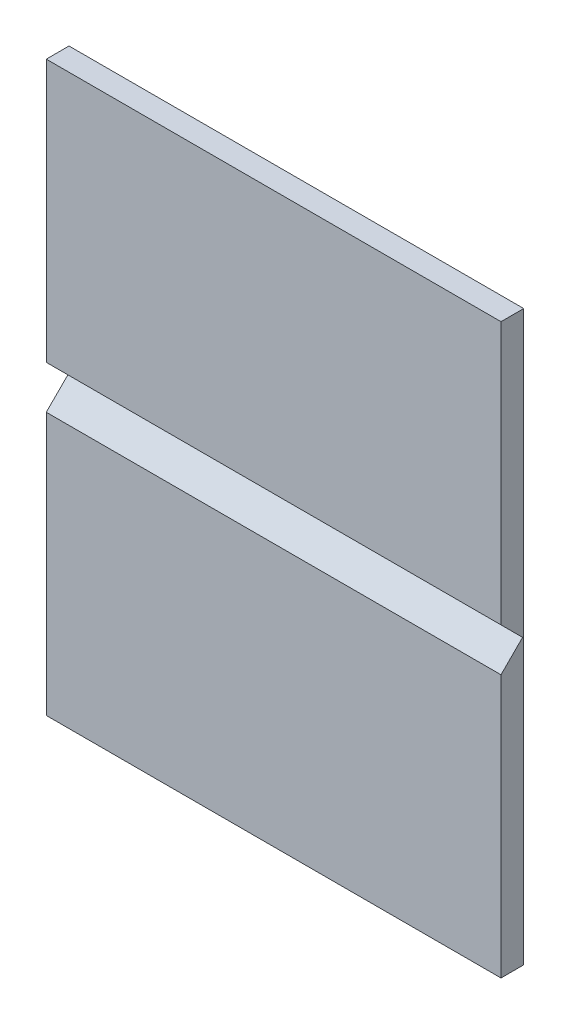
from build123d import *

# Parameters (mm, degrees)
SKETCH1_W           = 400
SKETCH1_H           = 500
BOSS_EXTRUDE1_DEPTH = 20
CUT_EXTRUDE2_DEPTH  = 473.122865365


with BuildPart() as part:
    # Sketch1 → Boss-Extrude1 (new body)
    with BuildSketch(Plane.XY):
        Rectangle(SKETCH1_W, SKETCH1_H)
    extrude(amount=BOSS_EXTRUDE1_DEPTH)

    # Sketch2 → Cut-Extrude2 (cut, through all)
    with BuildSketch(Plane(origin=(200, 0, 0), x_dir=(0, 0, -1), z_dir=(1, 0, 0))):
        Polygon((-1, 0), (-20.657237149, 19.657237149), (-20.657237149, -19.657237149), align=None)
    extrude(amount=-CUT_EXTRUDE2_DEPTH, mode=Mode.SUBTRACT)


solid = part.part
